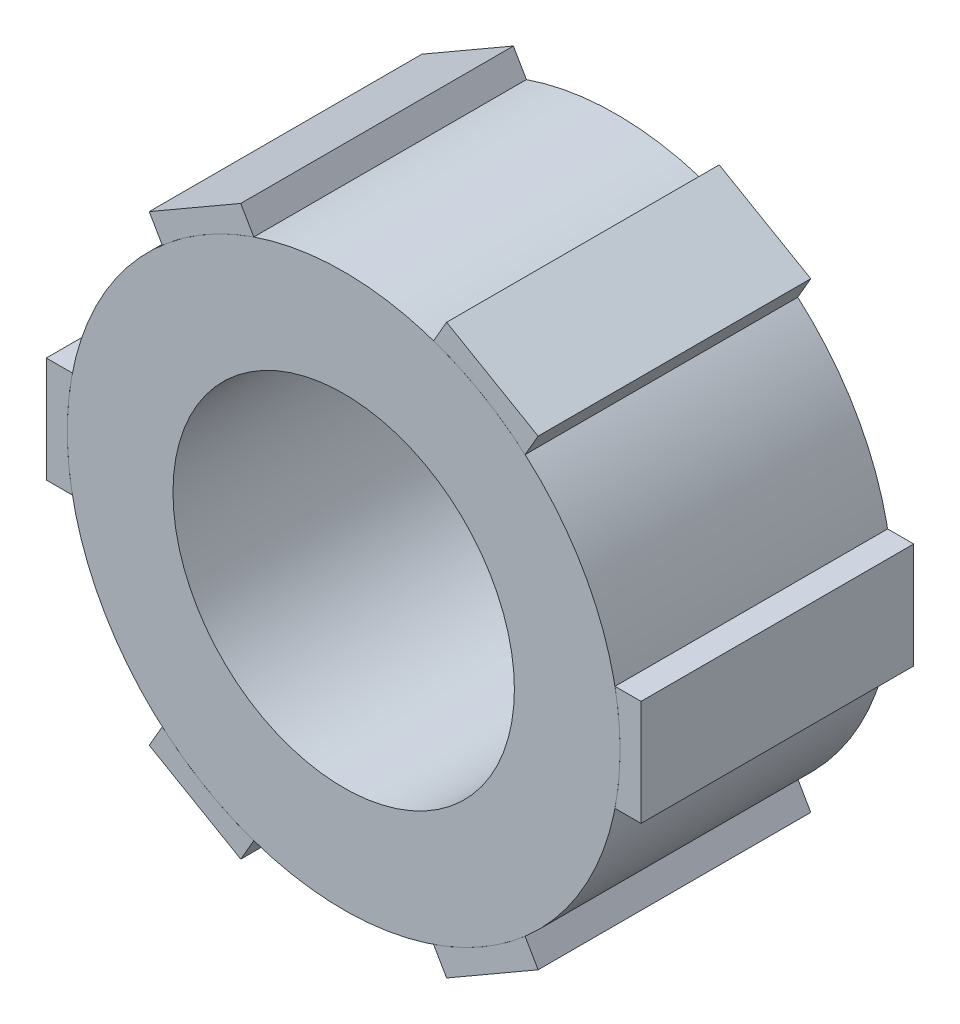
from build123d import *

# Parameters (mm, degrees)
SKETCH1_R             = 7.715
SKETCH1_R_2           = 4.765
BOSS_EXTRUDE1_DEPTH   = 7.61
BOSS_EXTRUDE3_DEPTH   = 7.61
BOSS_EXTRUDE3_2_DEPTH = 7.61
BOSS_EXTRUDE3_3_DEPTH = 7.61
BOSS_EXTRUDE3_4_DEPTH = 7.61
BOSS_EXTRUDE3_5_DEPTH = 7.61
BOSS_EXTRUDE3_6_DEPTH = 7.61


with BuildPart() as part:
    # Sketch1 → Boss-Extrude1 (new body)
    with BuildSketch(Plane.XY):
        Circle(SKETCH1_R)
        Circle(SKETCH1_R_2, mode=Mode.SUBTRACT)
    extrude(amount=BOSS_EXTRUDE1_DEPTH)


with BuildPart() as body_2:
    # Sketch3 → Boss-Extrude3 (new body)
    with BuildSketch(Plane.XY.offset(7.61)):
        with BuildLine():
            ThreePointArc((-7.572687766, -1.475), (-7.715, 0), (-7.572687766, 1.475))
            Line((-7.572687766, 1.475), (-8.3, 1.475))
            Line((-8.3, 1.475), (-8.3, -1.475))
            Line((-8.3, -1.475), (-7.572687766, -1.475))
        make_face()
    extrude(amount=-BOSS_EXTRUDE3_DEPTH)


with BuildPart() as body_3:
    # Sketch3 → Boss-Extrude3 2 (new body)
    with BuildSketch(Plane.XY.offset(7.61)):
        with BuildLine():
            Line((-2.508956412, 7.29563998), (-2.872612529, 7.925510851))
            Line((-2.872612529, 7.925510851), (-5.427387471, 6.450510851))
            Line((-5.427387471, 6.450510851), (-5.063731354, 5.82063998))
            ThreePointArc((-5.063731354, 5.82063998), (-3.8575, 6.68138599), (-2.508956412, 7.29563998))
        make_face()
    extrude(amount=-BOSS_EXTRUDE3_2_DEPTH)


with BuildPart() as body_4:
    # Sketch3 → Boss-Extrude3 3 (new body)
    with BuildSketch(Plane.XY.offset(7.61)):
        with BuildLine():
            Line((2.872612529, 7.925510851), (2.508956412, 7.29563998))
            ThreePointArc((2.508956412, 7.29563998), (3.8575, 6.68138599), (5.063731354, 5.82063998))
            Line((5.063731354, 5.82063998), (5.427387471, 6.450510851))
            Line((5.427387471, 6.450510851), (2.872612529, 7.925510851))
        make_face()
    extrude(amount=-BOSS_EXTRUDE3_3_DEPTH)


with BuildPart() as body_5:
    # Sketch3 → Boss-Extrude3 4 (new body)
    with BuildSketch(Plane.XY.offset(7.61)):
        with BuildLine():
            Line((8.3, 1.475), (7.572687766, 1.475))
            ThreePointArc((7.572687766, 1.475), (7.679339526, 0.740924722), (7.715, 0))
            ThreePointArc((7.715, 0), (7.679339526, -0.740924722), (7.572687766, -1.475))
            Line((7.572687766, -1.475), (8.3, -1.475))
            Line((8.3, -1.475), (8.3, 1.475))
        make_face()
    extrude(amount=-BOSS_EXTRUDE3_4_DEPTH)


with BuildPart() as body_6:
    # Sketch3 → Boss-Extrude3 5 (new body)
    with BuildSketch(Plane.XY.offset(7.61)):
        with BuildLine():
            Line((5.427387471, -6.450510851), (5.063731354, -5.82063998))
            ThreePointArc((5.063731354, -5.82063998), (3.8575, -6.68138599), (2.508956412, -7.29563998))
            Line((2.508956412, -7.29563998), (2.872612529, -7.925510851))
            Line((2.872612529, -7.925510851), (5.427387471, -6.450510851))
        make_face()
    extrude(amount=-BOSS_EXTRUDE3_5_DEPTH)


with BuildPart() as body_7:
    # Sketch3 → Boss-Extrude3 6 (new body)
    with BuildSketch(Plane.XY.offset(7.61)):
        with BuildLine():
            ThreePointArc((-2.508956412, -7.29563998), (-3.8575, -6.68138599), (-5.063731354, -5.82063998))
            Line((-5.063731354, -5.82063998), (-5.427387471, -6.450510851))
            Line((-5.427387471, -6.450510851), (-2.872612529, -7.925510851))
            Line((-2.872612529, -7.925510851), (-2.508956412, -7.29563998))
        make_face()
    extrude(amount=-BOSS_EXTRUDE3_6_DEPTH)


solid = Compound([part.part, body_2.part, body_3.part, body_4.part, body_5.part, body_6.part, body_7.part])
